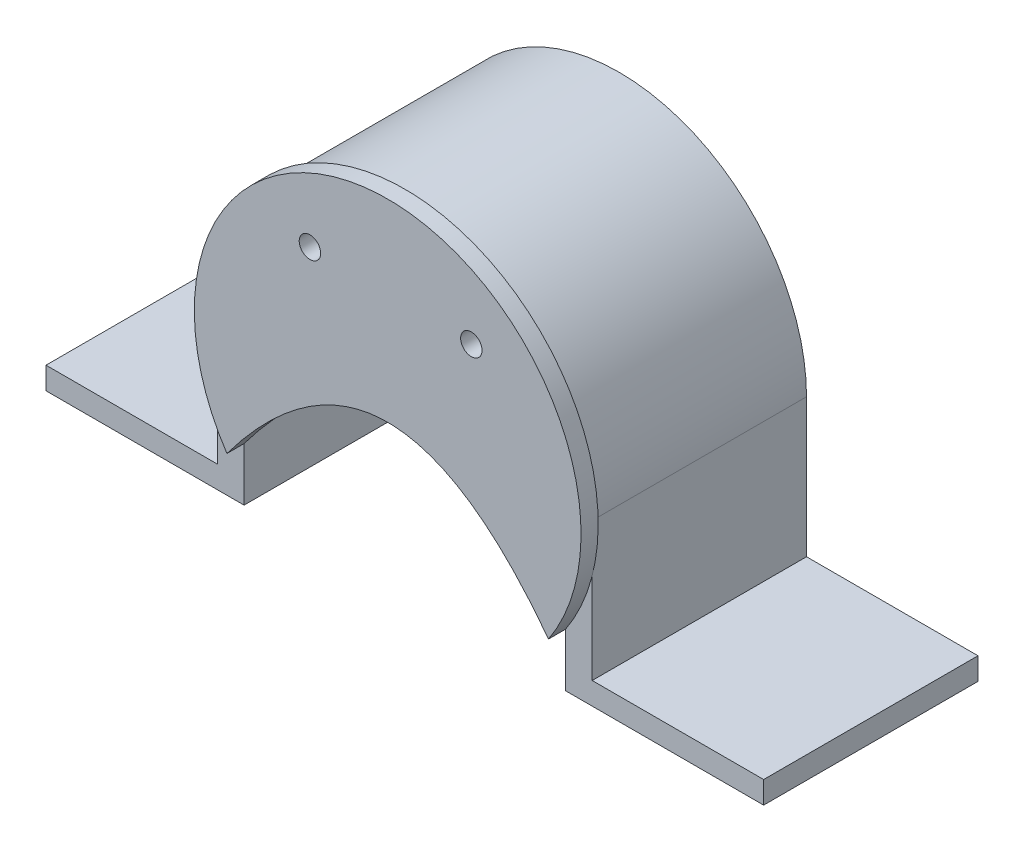
from build123d import *

# Parameters (mm, degrees)
BOSS_EXTRUDE1_DEPTH = 25
SKETCH2_R           = 1.25
BOSS_EXTRUDE2_DEPTH = 2


with BuildPart() as part:
    # Sketch1 → Boss-Extrude1 (new body)
    with BuildSketch(Plane.XY):
        with BuildLine():
            Line((18.75, 0), (18.75, -18.75))
            Line((18.75, -18.75), (36.000411031, -18.75))
            Line((36.000411031, -18.75), (41.851049495, -18.75))
            Line((41.851049495, -18.75), (41.851049495, -16.160388188))
            Line((41.851049495, -16.160388188), (21.851049495, -16.160388188))
            Line((21.851049495, -16.160388188), (21.851049495, 0))
            ThreePointArc((21.851049495, 0), (0, 21.851049495), (-21.851049495, 0))
            Line((-21.851049495, 0), (-21.851049495, -16.160388188))
            Line((-21.851049495, -16.160388188), (-41.851049495, -16.160388188))
            Line((-41.851049495, -16.160388188), (-41.851049495, -18.75))
            Line((-41.851049495, -18.75), (-18.75, -18.75))
            Line((-18.75, -18.75), (-18.75, 0))
            ThreePointArc((-18.75, 0), (0, 18.75), (18.75, 0))
        make_face()
    extrude(amount=BOSS_EXTRUDE1_DEPTH)


with BuildPart() as body_2:
    # Sketch2 → Boss-Extrude2 (new body)
    with BuildSketch(Plane.XY.offset(25)):
        with BuildLine():
            ThreePointArc((18.75, -12.530827957), (0, 22.551810333), (-18.75, -12.530827957))
            add(Edge.make_bspline(
                [(-18.75, -12.530827957), (0, 12.530827957), (18.75, -12.530827957)],
                knots=[0, 0, 0, 1, 1, 1], degree=2))
        make_face()
        with Locations((9.756436044, 12.751697465)):
            Circle(SKETCH2_R, mode=Mode.SUBTRACT)
        with Locations((-9.066924839, 13.151988727)):
            Circle(SKETCH2_R, mode=Mode.SUBTRACT)
    extrude(amount=BOSS_EXTRUDE2_DEPTH)


solid = Compound([part.part, body_2.part])
